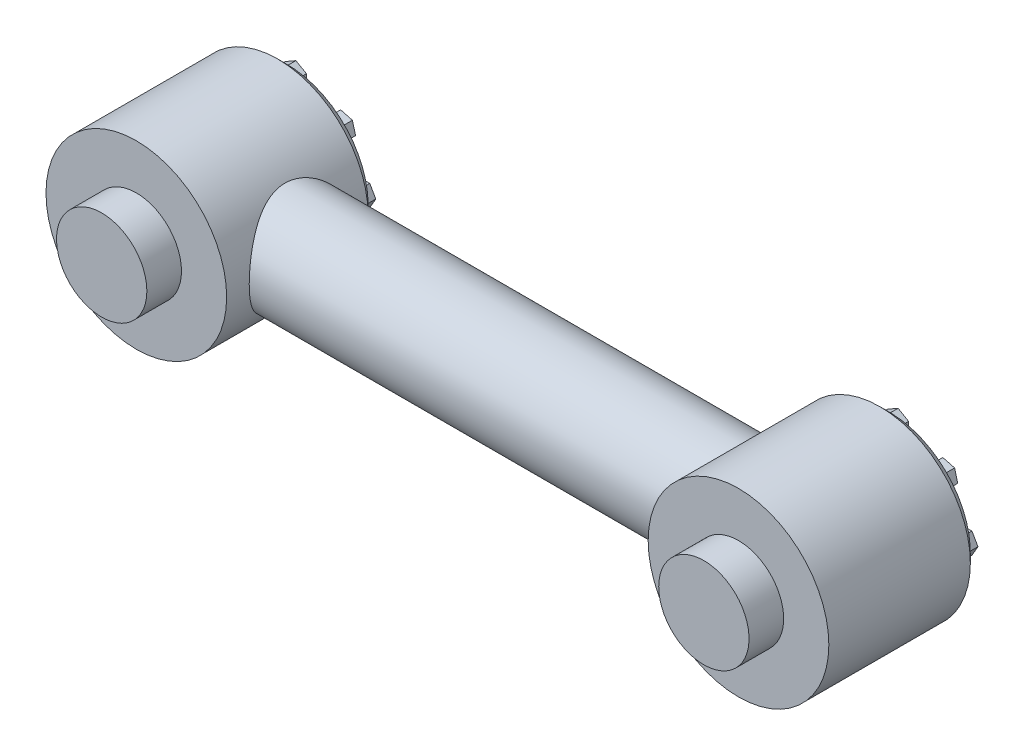
from build123d import *

# Parameters (mm, degrees)
SKETCH1_R                            = 30
BOSS_EXTRUDE1_DEPTH                  = 25
BOSS_EXTRUDE1_2_DEPTH                = 25
BOSS_EXTRUDE2_REACH                  = 137.739
BOSS_EXTRUDE2_END_RADIUS             = 30
SKETCH2_R                            = 17.5
BOSS_EXTRUDE2_DIRECTION_2_REACH      = 137.739
BOSS_EXTRUDE2_DIRECTION_2_END_RADIUS = 30
SKETCH3_R                            = 15
BOSS_EXTRUDE3_DEPTH                  = 11.5
CHAMFER1_SIZE                        = 3
BOSS_EXTRUDE4_DEPTH                  = 3
SKETCH6_R                            = 9.5
BOSS_EXTRUDE5_DEPTH                  = 4
BOSS_EXTRUDE5_TAPER                  = 6


with BuildPart() as part:
    # Sketch1 → Boss-Extrude1 (new, symmetric)
    with BuildSketch(Plane.XY):
        with Locations((-100, 0)):
            Circle(SKETCH1_R)
    extrude(amount=BOSS_EXTRUDE1_DEPTH, both=True)


with BuildPart() as body_2:
    # Sketch1 → Boss-Extrude1 2 (new, symmetric)
    with BuildSketch(Plane.XY):
        with Locations(Location((100, 0, 0), (0, 0, 180))):
            Circle(SKETCH1_R)
    extrude(amount=BOSS_EXTRUDE1_2_DEPTH, both=True)


    add(part.part)  # Boss-Extrude2 merges part
    # Boss-Extrude2: up to this cylinder (the profile starts outside it)
    boss_extrude2_end = Plane(origin=(-100, 0, 0), z_dir=(0, 0, -1)) * Cylinder(BOSS_EXTRUDE2_END_RADIUS, 336.478, mode=Mode.PRIVATE)
    # Sketch2 → Boss-Extrude2 (add, up to the surface)
    with BuildSketch(Plane(origin=(0, 0, 0), x_dir=(0, 0, -1), z_dir=(1, 0, 0)), mode=Mode.PRIVATE) as boss_extrude2_sk1:
        Circle(SKETCH2_R)
    boss_extrude2_tool1 = extrude(boss_extrude2_sk1.sketch, amount=-BOSS_EXTRUDE2_REACH, mode=Mode.PRIVATE) - boss_extrude2_end
    add(boss_extrude2_tool1.solids().sort_by_distance((0, 0, 0))[0])

    # Boss-Extrude2 direction 2: up to this cylinder (the profile starts outside it)
    boss_extrude2_direction_2_end = Plane(origin=(100, 0, 0), z_dir=(0, 0, -1)) * Cylinder(BOSS_EXTRUDE2_DIRECTION_2_END_RADIUS, 336.478, mode=Mode.PRIVATE)
    # Sketch2 → Boss-Extrude2 direction 2 (add, up to the surface)
    with BuildSketch(Plane(origin=(0, 0, 0), x_dir=(0, 0, -1), z_dir=(1, 0, 0)), mode=Mode.PRIVATE) as boss_extrude2_direction_2_sk1:
        Circle(SKETCH2_R)
    boss_extrude2_direction_2_tool1 = extrude(boss_extrude2_direction_2_sk1.sketch, amount=BOSS_EXTRUDE2_DIRECTION_2_REACH, mode=Mode.PRIVATE) - boss_extrude2_direction_2_end
    add(boss_extrude2_direction_2_tool1.solids().sort_by_distance((0, 0, 0))[0])

    # Sketch3 → Boss-Extrude3 (add)
    with BuildSketch(Plane.XY.offset(25)):
        with Locations((-100, 0)):
            Circle(SKETCH3_R)
    boss_extrude3 = extrude(amount=BOSS_EXTRUDE3_DEPTH)

    # Chamfer1
    chamfer1_edges = [body_2.edges().sort_by_distance(p)[0] for p in [
        (130, 0, -25),
        (-130, 0, -25),
    ]]
    chamfer(chamfer1_edges, length=CHAMFER1_SIZE)

    # Sketch5 → Boss-Extrude4 (add)
    with BuildSketch(Plane(origin=(0, 0, -25), x_dir=(-1, 0, 0), z_dir=(0, 0, -1))):
        Polygon((118.768667247, 18.768667247), (114.864924496, 19.814671965), (112.007186463, 16.956933931), (113.053191181, 13.053191181), (116.956933931, 12.007186463), (119.814671965, 14.864924496), align=None)
        Polygon((100, 26.542903769), (96.5, 24.522177826), (96.5, 20.480725942), (100, 18.46), (103.5, 20.480725942), (103.5, 24.522177826), align=None)
        Polygon((126.542903769, 0), (124.522177826, 3.5), (120.480725942, 3.5), (118.46, 0), (120.480725942, -3.5), (124.522177826, -3.5), align=None)
        Polygon((118.768667247, -18.768667247), (119.814671965, -14.864924496), (116.956933931, -12.007186463), (113.053191181, -13.053191181), (112.007186463, -16.956933931), (114.864924496, -19.814671965), align=None)
        Polygon((100, -26.542903769), (103.5, -24.522177826), (103.5, -20.480725942), (100, -18.46), (96.5, -20.480725942), (96.5, -24.522177826), align=None)
        Polygon((81.231332753, -18.768667247), (85.135075504, -19.814671965), (87.992813537, -16.956933931), (86.946808819, -13.053191181), (83.043066069, -12.007186463), (80.185328035, -14.864924496), align=None)
        Polygon((73.457096231, 0), (75.477822174, -3.5), (79.519274058, -3.5), (81.54, 0), (79.519274058, 3.5), (75.477822174, 3.5), align=None)
        Polygon((81.231332753, 18.768667247), (80.185328035, 14.864924496), (83.043066069, 12.007186463), (86.946808819, 13.053191181), (87.992813537, 16.956933931), (85.135075504, 19.814671965), align=None)
    boss_extrude4 = extrude(amount=BOSS_EXTRUDE4_DEPTH)

    # Sketch6 → Boss-Extrude5 (add)
    with BuildSketch(Plane(origin=(0, 0, -25), x_dir=(-1, 0, 0), z_dir=(0, 0, -1))):
        with Locations((100, 0)):
            Circle(SKETCH6_R)
    boss_extrude5 = extrude(amount=BOSS_EXTRUDE5_DEPTH, taper=BOSS_EXTRUDE5_TAPER)

    # Mirror1: Boss-Extrude3, Boss-Extrude4, Boss-Extrude5 across plane
    add(boss_extrude3.mirror(Plane(origin=(0, 0, 0), x_dir=(0, 0, 1), z_dir=(1, 0, 0))))
    add(boss_extrude4.mirror(Plane(origin=(0, 0, 0), x_dir=(0, 0, 1), z_dir=(1, 0, 0))))
    add(boss_extrude5.mirror(Plane(origin=(0, 0, 0), x_dir=(0, 0, 1), z_dir=(1, 0, 0))))


solid = body_2.part
